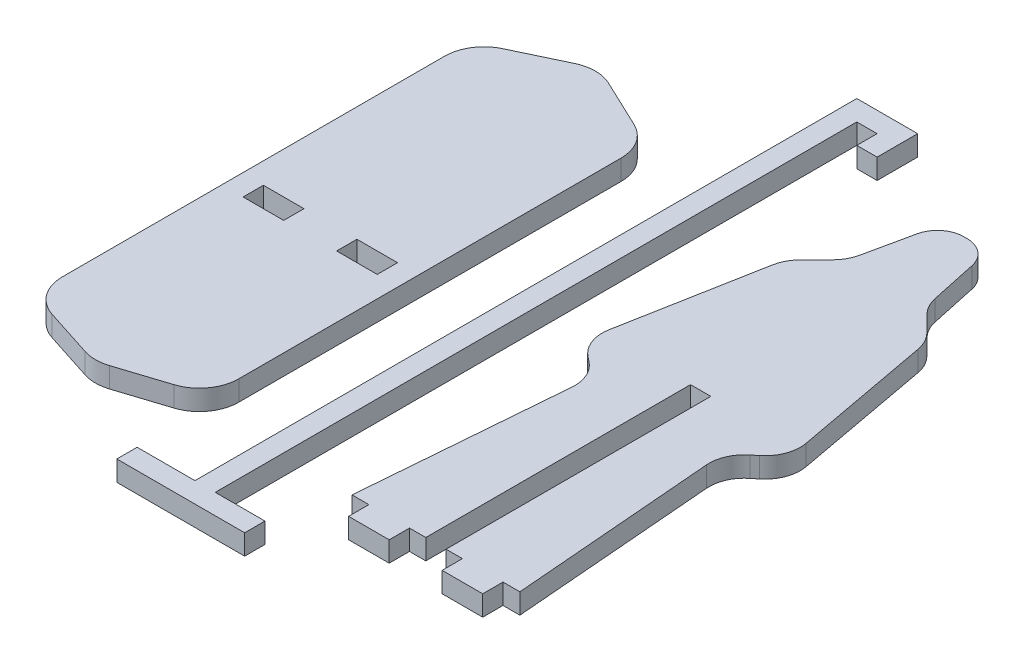
from build123d import *

# Parameters (mm, degrees)
BOSS_EXTRUDE1_DEPTH   = 2.3
SKIER_W               = 4.6
SKIER_H               = 2.3
BOSS_EXTRUDE1_2_DEPTH = 2.3
BOSS_EXTRUDE1_3_DEPTH = 2.3


with BuildPart() as part:
    # skier → Boss-Extrude1 (new body)
    with BuildSketch(Plane(origin=(0, 0, 0), x_dir=(1, 0, 0), z_dir=(0, 1, 0))):
        Polygon((-1.15, 37.5), (5.75, 37.5), (5.75, 32.9), (3.45, 32.9), (3.45, 35.2), (1.15, 35.2), (1.15, -37.5), (6.784344809, -37.5), (6.784344809, -39.8), (-7.702471438, -39.8), (-7.702471438, -37.5), (-1.15, -37.5), align=None)
    extrude(amount=BOSS_EXTRUDE1_DEPTH)


with BuildPart() as body_2:
    # skier → Boss-Extrude1 2 (new body)
    with BuildSketch(Plane(origin=(0, 0, 0), x_dir=(1, 0, 0), z_dir=(0, 1, 0))):
        with BuildLine():
            Line((-20.572488584, 24.952130677), (-26.110552293, 22.324426081))
            ThreePointArc((-26.110552293, 22.324426081), (-27.968995996, 20.678039707), (-28.659772453, 18.293248527))
            Line((-28.659772453, 18.293248527), (-28.659772453, -25.021233516))
            ThreePointArc((-28.659772453, -25.021233516), (-27.804918966, -27.647605369), (-25.567917858, -29.267614518))
            Line((-25.567917858, -29.267614518), (-20.029854149, -31.054453644))
            ThreePointArc((-20.029854149, -31.054453644), (-18.659772453, -31.270008933), (-17.289690758, -31.054453644))
            Line((-17.289690758, -31.054453644), (-11.751627049, -29.267614518))
            ThreePointArc((-11.751627049, -29.267614518), (-9.514625941, -27.647605369), (-8.659772453, -25.021233516))
            Line((-8.659772453, -25.021233516), (-8.659772453, 18.293248527))
            ThreePointArc((-8.659772453, 18.293248527), (-9.350548911, 20.678039707), (-11.208992614, 22.324426081))
            Line((-11.208992614, 22.324426081), (-16.747056323, 24.952130677))
            ThreePointArc((-16.747056323, 24.952130677), (-18.659772453, 25.382889415), (-20.572488584, 24.952130677))
        make_face()
        with Locations((-13.359772453, -5.784651227)):
            Rectangle(SKIER_W, SKIER_H, mode=Mode.SUBTRACT)
        with Locations((-23.959772453, -5.784651227)):
            Rectangle(SKIER_W, SKIER_H, mode=Mode.SUBTRACT)
    extrude(amount=BOSS_EXTRUDE1_2_DEPTH)


with BuildPart() as body_3:
    # skier → Boss-Extrude1 3 (new body)
    with BuildSketch(Plane(origin=(0, 0, 0), x_dir=(1, 0, 0), z_dir=(0, 1, 0))):
        with BuildLine():
            Line((18.473631222, 30), (18.845913685, 30))
            ThreePointArc((18.845913685, 30), (20.73194632, 29.332998264), (21.779320927, 27.628587266))
            Line((21.779320927, 27.628587266), (22.922237033, 22.29497877))
            ThreePointArc((22.922237033, 22.29497877), (23.31530066, 21.229769479), (23.991832273, 20.317917065))
            Line((23.991832273, 20.317917065), (25.83043446, 18.462049206))
            ThreePointArc((25.83043446, 18.462049206), (26.532973857, 17.501318165), (26.921730325, 16.376402992))
            Line((26.921730325, 16.376402992), (29.811362053, 0.798382112))
            ThreePointArc((29.811362053, 0.798382112), (29.625168549, -1.331904313), (28.368166135, -3.061856106))
            Line((28.368166135, -3.061856106), (27.785234308, -3.525436388))
            ThreePointArc((27.785234308, -3.525436388), (26.604421446, -5.066416405), (26.288233028, -6.981870219))
            Line((26.288233028, -6.981870219), (28.168888078, -30))
            Line((28.168888078, -30), (26.259772453, -30))
            Line((26.259772453, -30), (26.259772453, -32.3))
            Line((26.259772453, -32.3), (21.659772453, -32.3))
            Line((21.659772453, -32.3), (21.659772453, -30))
            Line((21.659772453, -30), (19.809772453, -30))
            Line((19.809772453, -30), (19.809772453, 0))
            Line((19.809772453, 0), (17.509772453, 0))
            Line((17.509772453, 0), (17.509772453, -30))
            Line((17.509772453, -30), (15.659772453, -30))
            Line((15.659772453, -30), (15.659772453, -32.3))
            Line((15.659772453, -32.3), (11.059772453, -32.3))
            Line((11.059772453, -32.3), (11.059772453, -30))
            Line((11.059772453, -30), (9.150656829, -30))
            Line((9.150656829, -30), (11.031311879, -6.981870219))
            ThreePointArc((11.031311879, -6.981870219), (10.715123461, -5.066416405), (9.534310599, -3.525436388))
            Line((9.534310599, -3.525436388), (8.951378772, -3.061856106))
            ThreePointArc((8.951378772, -3.061856106), (7.694376358, -1.331904313), (7.508182854, 0.798382112))
            Line((7.508182854, 0.798382112), (10.397814582, 16.376402992))
            ThreePointArc((10.397814582, 16.376402992), (10.78657105, 17.501318165), (11.489110447, 18.462049206))
            Line((11.489110447, 18.462049206), (13.327712634, 20.317917065))
            ThreePointArc((13.327712634, 20.317917065), (14.004244247, 21.229769479), (14.397307874, 22.29497877))
            Line((14.397307874, 22.29497877), (15.54022398, 27.628587266))
            ThreePointArc((15.54022398, 27.628587266), (16.587598587, 29.332998264), (18.473631222, 30))
        make_face()
    extrude(amount=BOSS_EXTRUDE1_3_DEPTH)


solid = Compound([part.part, body_2.part, body_3.part])
